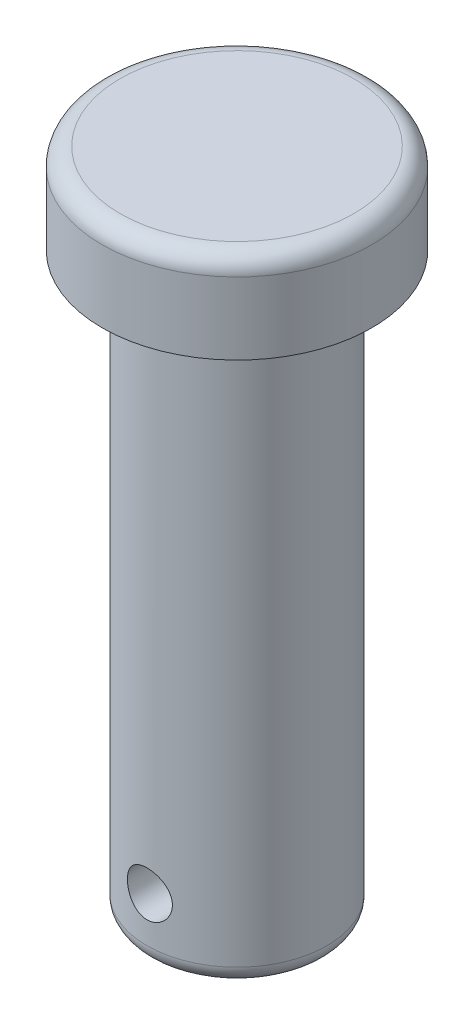
from build123d import *

# Parameters (mm, degrees)
SKETCH1_R               = 10
BOSS_EXTRUDE1_DEPTH     = 64
SKETCH2_R               = 15
BOSS_EXTRUDE2_DEPTH     = 10
CUT_EXTRUDE1_DEPTH      = 77.980517016
CUT_EXTRUDE1_DEPTH_BACK = 77.980517016
SKETCH3_R               = 2.5
FILLET1_R               = 2


with BuildPart() as part:
    # Sketch1 → Boss-Extrude1 (new body)
    with BuildSketch(Plane(origin=(0, 0, 0), x_dir=(1, 0, 0), z_dir=(0, 1, 0))):
        with Locations(Location((0, 0, 0), (0, 0, 270))):
            Circle(SKETCH1_R)
    extrude(amount=BOSS_EXTRUDE1_DEPTH)

    # Sketch2 → Boss-Extrude2 (add)
    with BuildSketch(Plane(origin=(0, 64, 0), x_dir=(1, 0, 0), z_dir=(0, 1, 0))):
        with Locations(Location((0, 0, 0), (0, 0, 270))):
            Circle(SKETCH2_R)
    extrude(amount=BOSS_EXTRUDE2_DEPTH)

    # Sketch3 → Cut-Extrude1 (cut, two sides: drawn at the far end of the back side and taken through both)
    with BuildSketch(Plane.XY.offset(-CUT_EXTRUDE1_DEPTH_BACK)):
        with Locations(Location((0, 7, 0), (0, 0, 90.000000004))):
            Circle(SKETCH3_R)
    extrude(amount=CUT_EXTRUDE1_DEPTH + CUT_EXTRUDE1_DEPTH_BACK, mode=Mode.SUBTRACT)

    # Fillet1
    fillet1_edges = [part.edges().sort_by_distance(p)[0] for p in [
        (0, 0, -10),
        (0, 74, -15),
    ]]
    fillet(fillet1_edges, radius=FILLET1_R)


solid = part.part
